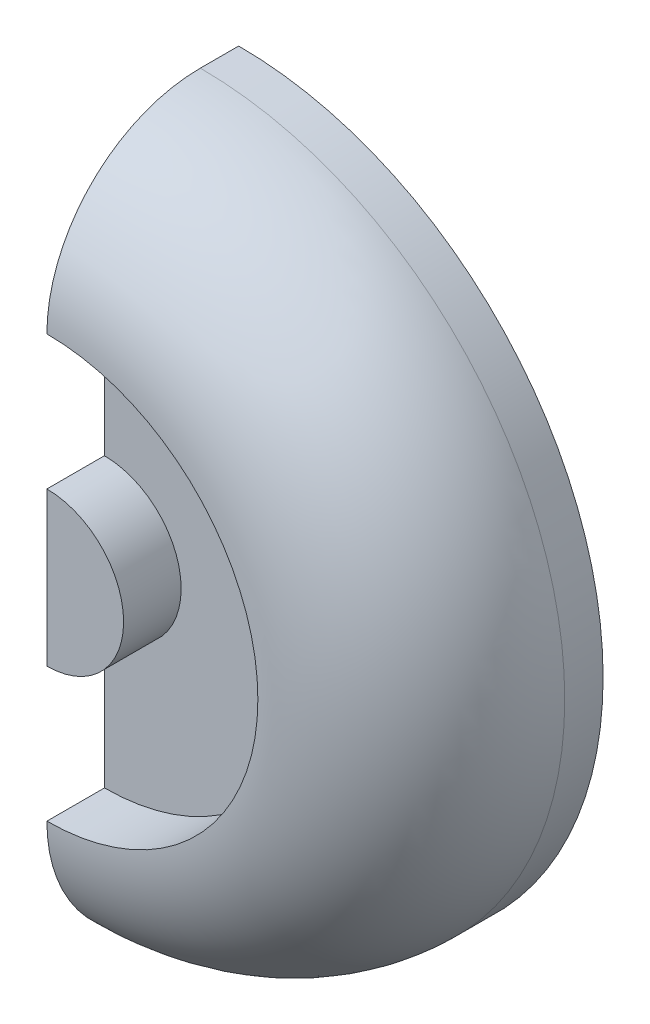
from build123d import *

# Parameters (mm, degrees)
SKETCH1_R           = 47.5
BOSS_EXTRUDE2_DEPTH = 25
FILLET1_R           = 20
SKETCH3_R           = 10
BOSS_EXTRUDE3_DEPTH = 5
SKETCH4_R           = 27.5
CUT_EXTRUDE1_DEPTH  = 7.5
SKETCH5_R           = 10
BOSS_EXTRUDE5_DEPTH = 7.5
SKETCH6_W           = 48.682304138
SKETCH6_H           = 105.772137124
CUT_EXTRUDE2_DEPTH  = 50
SCALE4_SCALE        = 1.15


with BuildPart() as part:
    # Sketch1 → Boss-Extrude2 (new body)
    with BuildSketch(Plane.XY):
        Circle(SKETCH1_R)
    extrude(amount=BOSS_EXTRUDE2_DEPTH)

    # Fillet1
    fillet1_edges = [part.edges().sort_by_distance(p)[0] for p in [
        (-47.5, 0, 25),
    ]]
    fillet(fillet1_edges, radius=FILLET1_R)

    # Sketch3 → Boss-Extrude3 (add)
    with BuildSketch(Plane.XY.offset(25)):
        Circle(SKETCH3_R)
    extrude(amount=-BOSS_EXTRUDE3_DEPTH)

    # Sketch4 → Cut-Extrude1 (cut)
    with BuildSketch(Plane.XY.offset(25)):
        Circle(SKETCH4_R)
    extrude(amount=-CUT_EXTRUDE1_DEPTH, mode=Mode.SUBTRACT)

    # Sketch5 → Boss-Extrude5 (add)
    with BuildSketch(Plane.XY.offset(17.5)):
        Circle(SKETCH5_R)
    extrude(amount=BOSS_EXTRUDE5_DEPTH)

    # Sketch6 → Cut-Extrude2 (cut)
    with BuildSketch(Plane.XY.offset(25)):
        with Locations((-24.341152069, -1.830671604)):
            Rectangle(SKETCH6_W, SKETCH6_H)
    extrude(amount=-CUT_EXTRUDE2_DEPTH, mode=Mode.SUBTRACT)


with BuildPart() as part_1:
    # Scale4: scaled about (19.733587982, 0, 10.209783997)
    add(part.part.scale(SCALE4_SCALE).moved(Location((-2.960038197, 0, -1.5314676))))


solid = part_1.part
